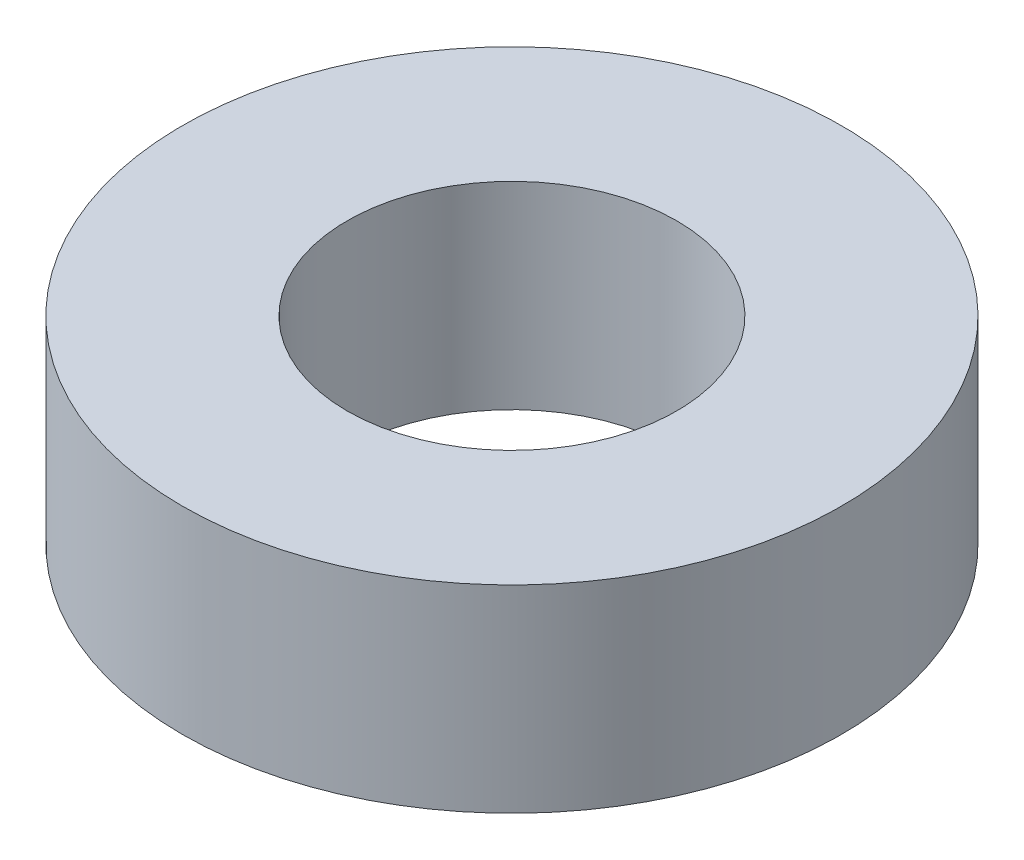
from build123d import *

# Parameters (mm, degrees)
SKETCH_1_R      = 5
SKETCH_1_R_2    = 2.5
EXTRUDE_1_DEPTH = 3


with BuildPart() as part:
    # 草图1 → 凸台-拉伸1 (new body)
    with BuildSketch(Plane(origin=(0, 0, 0), x_dir=(1, 0, 0), z_dir=(0, 1, 0))):
        with Locations(Location((0, 0, 0), (0, 0, 270))):
            Circle(SKETCH_1_R)
        with Locations(Location((0, 0, 0), (0, 0, 270))):
            Circle(SKETCH_1_R_2, mode=Mode.SUBTRACT)
    extrude(amount=EXTRUDE_1_DEPTH)


solid = part.part
